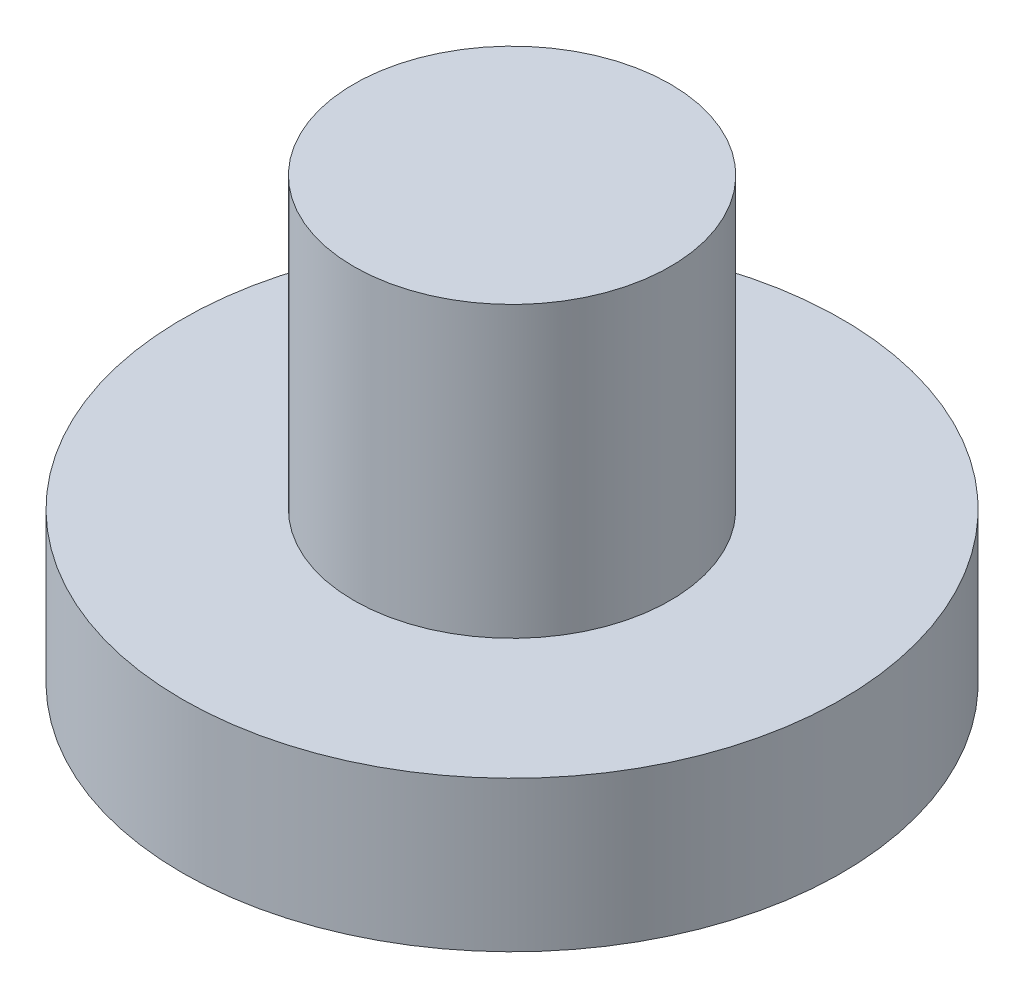
from build123d import *

# Parameters (mm, degrees)
SKETCH1_R           = 7.5
SKETCH1_R_2         = 3.6
BOSS_EXTRUDE1_DEPTH = 3.42
SKETCH1_2_R         = 3.6
BOSS_EXTRUDE2_DEPTH = 10


with BuildPart() as part:
    # Sketch1 → Boss-Extrude1 (new body)
    with BuildSketch(Plane(origin=(0, 0, 0), x_dir=(1, 0, 0), z_dir=(0, 1, 0))):
        Circle(SKETCH1_R)
        Circle(SKETCH1_R_2, mode=Mode.SUBTRACT)
    extrude(amount=BOSS_EXTRUDE1_DEPTH)

    # Sketch1<2> → Boss-Extrude2 (add)
    with BuildSketch(Plane(origin=(0, 0, 0), x_dir=(1, 0, 0), z_dir=(0, 1, 0))):
        Circle(SKETCH1_2_R)
    extrude(amount=BOSS_EXTRUDE2_DEPTH)


solid = part.part
